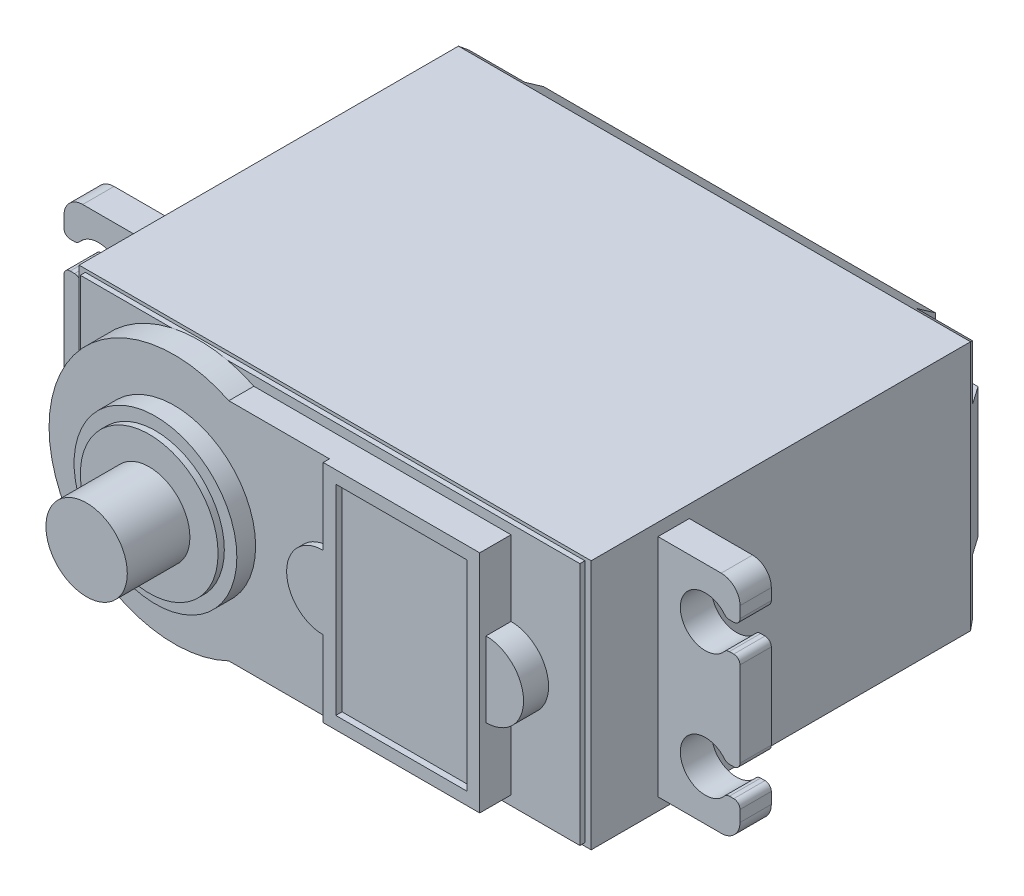
from build123d import *
from OCP.BRepFilletAPI import BRepFilletAPI_MakeChamfer

# Parameters (mm, degrees)
SKETCH1_W            = 40.9
SKETCH1_H            = 20
BOSS_EXTRUDE1_DEPTH  = 19.3
SKETCH2_W            = 40.9
SKETCH2_H            = 20
BOSS_EXTRUDE2_DEPTH  = 6.5
SKETCH3_W            = 40.9
SKETCH3_H            = 20
BOSS_EXTRUDE3_DEPTH  = 6.5
CHAMFER1_SIZE        = 2
CHAMFER1_SIZE2       = 1.400415076
CUT_EXTRUDE1_DEPTH   = 1.5
SKETCH5_W            = 39.9
SKETCH5_H            = 19.5
BOSS_EXTRUDE4_DEPTH  = 0.4
BOSS_EXTRUDE5_DEPTH  = 2
SKETCH7_R            = 6.5
BOSS_EXTRUDE6_DEPTH  = 1.5
SKETCH8_R            = 5.5
BOSS_EXTRUDE7_DEPTH  = 0.5
SKETCH9_R            = 3.25
BOSS_EXTRUDE8_DEPTH  = 5
SKETCH10_W           = 10.5
SKETCH10_H           = 15.998933302
BOSS_EXTRUDE9_DEPTH  = 0.5
BOSS_EXTRUDE10_START = -5.74
BOSS_EXTRUDE10_DEPTH = 2.5


with BuildPart() as part:
    # Sketch1 → Boss-Extrude1 (new body)
    with BuildSketch(Plane.XY):
        Rectangle(SKETCH1_W, SKETCH1_H)
    extrude(amount=BOSS_EXTRUDE1_DEPTH)

    # Sketch2 → Boss-Extrude2 (add)
    with BuildSketch(Plane(origin=(0, 0, 0), x_dir=(-1, 0, 0), z_dir=(0, 0, -1))):
        Rectangle(SKETCH2_W, SKETCH2_H)
    extrude(amount=BOSS_EXTRUDE2_DEPTH)

    # Sketch3 → Boss-Extrude3 (add)
    with BuildSketch(Plane.XY.offset(19.3)):
        Rectangle(SKETCH3_W, SKETCH3_H)
    extrude(amount=BOSS_EXTRUDE3_DEPTH)

    # Chamfer1: one chamfer whose edges measure the first distance from different faces: ONE call of the kernel's chamfer builder (chamfer() names one face for all edges)
    chamfer1_edges_1 = [part.edges().sort_by_distance(p)[0] for p in [
        (0, 10, -6.5),
    ]]
    chamfer1_side_1 = [part.faces().sort_by_distance(p)[0] for p in [
        (0, 10, 9.65),
    ]]
    chamfer1_edges_2 = [part.edges().sort_by_distance(p)[0] for p in [
        (20.45, 0, -6.5),
    ]]
    chamfer1_side_2 = [part.faces().sort_by_distance(p)[0] for p in [
        (20.45, 0, 9.65),
    ]]
    chamfer1_edges_3 = [part.edges().sort_by_distance(p)[0] for p in [
        (0, -10, -6.5),
    ]]
    chamfer1_side_3 = [part.faces().sort_by_distance(p)[0] for p in [
        (0, -10, 9.65),
    ]]
    chamfer1_edges_4 = [part.edges().sort_by_distance(p)[0] for p in [
        (-20.45, 0, -6.5),
    ]]
    chamfer1_side_4 = [part.faces().sort_by_distance(p)[0] for p in [
        (-20.45, 0, 9.65),
    ]]
    chamfer1 = BRepFilletAPI_MakeChamfer(part.part.solid().wrapped)
    for e in chamfer1_edges_1:
        chamfer1.Add(CHAMFER1_SIZE, CHAMFER1_SIZE2, e.wrapped, chamfer1_side_1[0].wrapped)  # the first distance lies on this face
    for e in chamfer1_edges_2:
        chamfer1.Add(CHAMFER1_SIZE, CHAMFER1_SIZE2, e.wrapped, chamfer1_side_2[0].wrapped)  # the first distance lies on this face
    for e in chamfer1_edges_3:
        chamfer1.Add(CHAMFER1_SIZE, CHAMFER1_SIZE2, e.wrapped, chamfer1_side_3[0].wrapped)  # the first distance lies on this face
    for e in chamfer1_edges_4:
        chamfer1.Add(CHAMFER1_SIZE, CHAMFER1_SIZE2, e.wrapped, chamfer1_side_4[0].wrapped)  # the first distance lies on this face
    add(Compound.cast(chamfer1.Shape()), mode=Mode.REPLACE)

    # Sketch4 → Cut-Extrude1 (cut)
    with BuildSketch(Plane(origin=(0, 0, -6.5), x_dir=(-1, 0, 0), z_dir=(0, 0, -1))):
        with BuildLine():
            Line((-20.45, 10), (-15.65, 10))
            Line((-15.65, 10), (-15.65, 7.2))
            ThreePointArc((-15.65, 7.2), (-16.235786438, 5.785786438), (-17.65, 5.2))
            Line((-17.65, 5.2), (-20.45, 5.2))
            Line((-20.45, 5.2), (-20.45, 10))
        make_face()
        with BuildLine():
            Line((15.65, 10), (15.65, 7.2))
            ThreePointArc((15.65, 7.2), (16.235786438, 5.785786438), (17.65, 5.2))
            Line((17.65, 5.2), (20.45, 5.2))
            Line((20.45, 5.2), (20.45, 10))
            Line((20.45, 10), (15.65, 10))
        make_face()
        with BuildLine():
            Line((20.45, -10), (15.65, -10))
            Line((15.65, -10), (15.65, -7.2))
            ThreePointArc((15.65, -7.2), (16.235786438, -5.785786438), (17.65, -5.2))
            Line((17.65, -5.2), (20.45, -5.2))
            Line((20.45, -5.2), (20.45, -10))
        make_face()
        with BuildLine():
            Line((-15.65, -10), (-15.65, -7.2))
            ThreePointArc((-15.65, -7.2), (-16.235786438, -5.785786438), (-17.65, -5.2))
            Line((-17.65, -5.2), (-20.45, -5.2))
            Line((-20.45, -5.2), (-20.45, -10))
            Line((-20.45, -10), (-15.65, -10))
        make_face()
    extrude(amount=-CUT_EXTRUDE1_DEPTH, mode=Mode.SUBTRACT)

    # Sketch5 → Boss-Extrude4 (add)
    with BuildSketch(Plane.XY.offset(25.8)):
        Rectangle(SKETCH5_W, SKETCH5_H)
    extrude(amount=BOSS_EXTRUDE4_DEPTH)

    # Sketch6 → Boss-Extrude5 (add)
    with BuildSketch(Plane.XY.offset(26.2)):
        with BuildLine():
            Line((-6.09, 8.999466651), (14.45, 8.999466651))
            Line((14.45, 8.999466651), (14.45, 3))
            ThreePointArc((14.45, 3), (17.45, 0), (14.45, -3))
            Line((14.45, -3), (14.45, -8.999466651))
            Line((14.45, -8.999466651), (-6.09, -8.999466651))
            ThreePointArc((-6.09, -8.999466651), (-20.45, 0), (-6.09, 8.999466651))
        make_face()
    extrude(amount=BOSS_EXTRUDE5_DEPTH)

    # Sketch7 → Boss-Extrude6 (add)
    with BuildSketch(Plane.XY.offset(28.2)):
        with Locations((-10.45, 0)):
            Circle(SKETCH7_R)
    extrude(amount=BOSS_EXTRUDE6_DEPTH)

    # Sketch8 → Boss-Extrude7 (add)
    with BuildSketch(Plane.XY.offset(29.7)):
        with Locations((-10.45, 0)):
            Circle(SKETCH8_R)
    extrude(amount=BOSS_EXTRUDE7_DEPTH)

    # Sketch9 → Boss-Extrude8 (add)
    with BuildSketch(Plane.XY.offset(30.2)):
        with Locations((-10.45, 0)):
            Circle(SKETCH9_R)
    extrude(amount=BOSS_EXTRUDE8_DEPTH)

    # Sketch10 → Boss-Extrude9 (add)
    with BuildSketch(Plane.XY.offset(28.2)):
        with BuildLine():
            Line((1.95, 8.999466651), (14.45, 8.999466651))
            Line((14.45, 8.999466651), (14.45, -8.999466651))
            Line((14.45, -8.999466651), (1.95, -8.999466651))
            Line((1.95, -8.999466651), (1.95, -2.925))
            ThreePointArc((1.95, -2.925), (-0.975, 0), (1.95, 2.925))
            Line((1.95, 2.925), (1.95, 8.999466651))
        make_face()
        with Locations((8.2, 0)):
            Rectangle(SKETCH10_W, SKETCH10_H, mode=Mode.SUBTRACT)
    extrude(amount=BOSS_EXTRUDE9_DEPTH)

    # Sketch11 → Boss-Extrude10 (add)
    with BuildSketch(Plane.XY.offset(26.2).offset(BOSS_EXTRUDE10_START)):
        with BuildLine():
            Line((20.45, 9), (25.5, 9))
            ThreePointArc((25.5, 9), (26.560660172, 8.560660172), (27, 7.5))
            Line((27, 7.5), (27, 6.601517979))
            ThreePointArc((27, 6.601517979), (26.853553391, 6.247964588), (26.5, 6.101517979))
            Line((26.5, 6.101517979), (26.150343239, 6.101517979))
            ThreePointArc((26.150343239, 6.101517979), (25.938390176, 6.148664914), (25.766408861, 6.281214383))
            ThreePointArc((25.766408861, 6.281214383), (22.23067135, 5), (25.766408861, 3.718785617))
            ThreePointArc((25.766408861, 3.718785617), (25.938390176, 3.851335086), (26.150343239, 3.898482021))
            Line((26.150343239, 3.898482021), (26.5, 3.898482021))
            ThreePointArc((26.5, 3.898482021), (26.853553391, 3.752035412), (27, 3.398482021))
            Line((27, 3.398482021), (27, -3.398482021))
            ThreePointArc((27, -3.398482021), (26.853553391, -3.752035412), (26.5, -3.898482021))
            Line((26.5, -3.898482021), (26.150343239, -3.898482021))
            ThreePointArc((26.150343239, -3.898482021), (25.938390176, -3.851335086), (25.766408861, -3.718785617))
            ThreePointArc((25.766408861, -3.718785617), (22.23067135, -5), (25.766408861, -6.281214383))
            ThreePointArc((25.766408861, -6.281214383), (25.938390176, -6.148664914), (26.150343239, -6.101517979))
            Line((26.150343239, -6.101517979), (26.5, -6.101517979))
            ThreePointArc((26.5, -6.101517979), (26.853553391, -6.247964588), (27, -6.601517979))
            Line((27, -6.601517979), (27, -7.5))
            ThreePointArc((27, -7.5), (26.560660172, -8.560660172), (25.5, -9))
            Line((25.5, -9), (20.45, -9))
            Line((20.45, -9), (20.45, 9))
        make_face()
        with BuildLine():
            Line((-20.45, -9), (-25.5, -9))
            ThreePointArc((-25.5, -9), (-26.560660172, -8.560660172), (-27, -7.5))
            Line((-27, -7.5), (-27, -6.601517979))
            ThreePointArc((-27, -6.601517979), (-26.853553391, -6.247964588), (-26.5, -6.101517979))
            Line((-26.5, -6.101517979), (-26.150343239, -6.101517979))
            ThreePointArc((-26.150343239, -6.101517979), (-25.938390176, -6.148664914), (-25.766408861, -6.281214383))
            ThreePointArc((-25.766408861, -6.281214383), (-22.23067135, -5), (-25.766408861, -3.718785617))
            ThreePointArc((-25.766408861, -3.718785617), (-25.938390176, -3.851335086), (-26.150343239, -3.898482021))
            Line((-26.150343239, -3.898482021), (-26.5, -3.898482021))
            ThreePointArc((-26.5, -3.898482021), (-26.853553391, -3.752035412), (-27, -3.398482021))
            Line((-27, -3.398482021), (-27, 3.398482021))
            ThreePointArc((-27, 3.398482021), (-26.853553391, 3.752035412), (-26.5, 3.898482021))
            Line((-26.5, 3.898482021), (-26.150343239, 3.898482021))
            ThreePointArc((-26.150343239, 3.898482021), (-25.938390176, 3.851335086), (-25.766408861, 3.718785617))
            ThreePointArc((-25.766408861, 3.718785617), (-22.23067135, 5), (-25.766408861, 6.281214383))
            ThreePointArc((-25.766408861, 6.281214383), (-25.938390176, 6.148664914), (-26.150343239, 6.101517979))
            Line((-26.150343239, 6.101517979), (-26.5, 6.101517979))
            ThreePointArc((-26.5, 6.101517979), (-26.853553391, 6.247964588), (-27, 6.601517979))
            Line((-27, 6.601517979), (-27, 7.5))
            ThreePointArc((-27, 7.5), (-26.560660172, 8.560660172), (-25.5, 9))
            Line((-25.5, 9), (-20.45, 9))
            Line((-20.45, 9), (-20.45, -9))
        make_face()
    extrude(amount=-BOSS_EXTRUDE10_DEPTH)


solid = part.part
